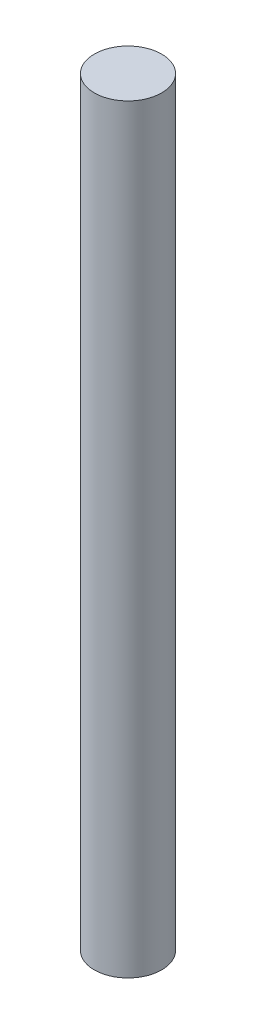
from build123d import *

# Parameters (mm, degrees)
SKETCH2_R           = 3.9
BOSS_EXTRUDE1_DEPTH = 88


with BuildPart() as part:
    # Sketch2 → Boss-Extrude1 (new body)
    with BuildSketch(Plane(origin=(0, 0, 0), x_dir=(1, 0, 0), z_dir=(0, 1, 0))):
        with Locations(Location((0, 0, 0), (0, 0, 270))):
            Circle(SKETCH2_R)
    extrude(amount=BOSS_EXTRUDE1_DEPTH)


solid = part.part
